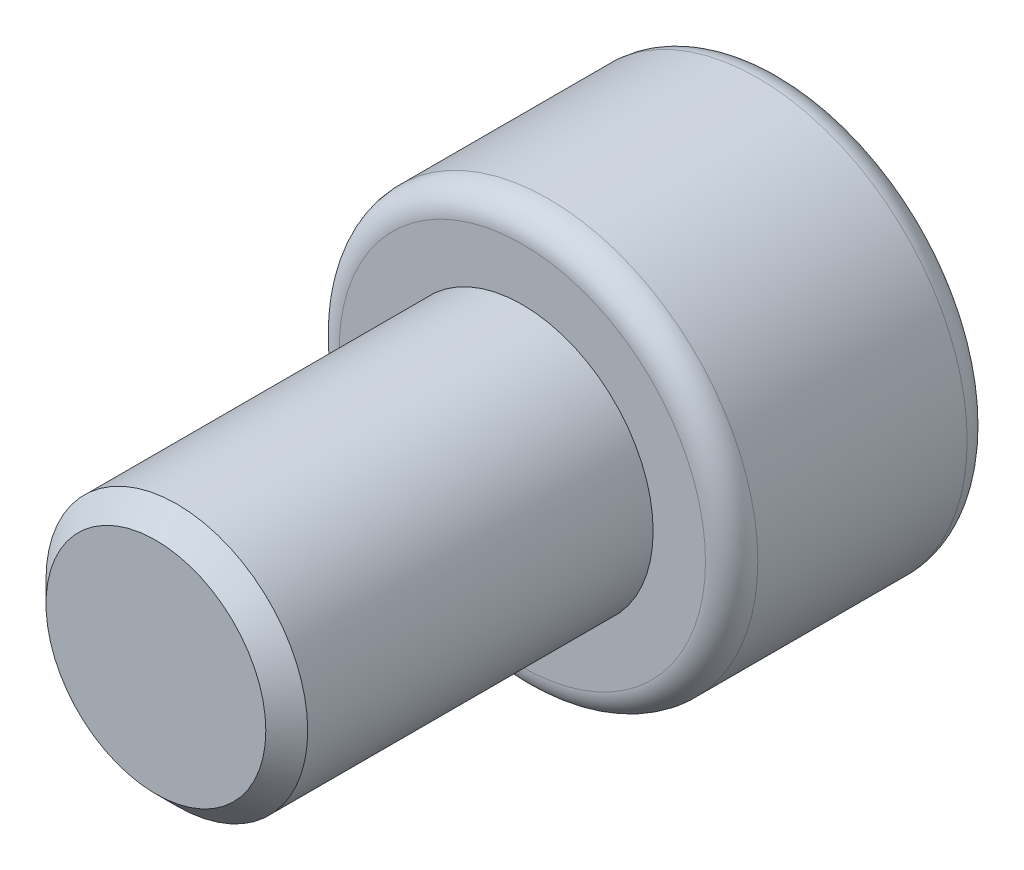
from build123d import *

# Parameters (mm, degrees)
ESBO_O1_R                = 4
RESSALTO_EXTRUS_O1_DEPTH = 5
ESBO_O2_R                = 2.5
RESSALTO_EXTRUS_O2_DEPTH = 7
CORTE_EXTRUS_O1_DEPTH    = 3
FILETE1_R                = 0.5
FILETE2_R                = 0.2
CHANFRO2_SIZE            = 0.4


with BuildPart() as part:
    # Esboço1 → Ressalto-extrusão1 (new body)
    with BuildSketch(Plane.XY):
        Circle(ESBO_O1_R)
    extrude(amount=RESSALTO_EXTRUS_O1_DEPTH)

    # Esboço2 → Ressalto-extrusão2 (add)
    with BuildSketch(Plane.XY.offset(5)):
        Circle(ESBO_O2_R)
    extrude(amount=RESSALTO_EXTRUS_O2_DEPTH)

    # Esboço3 → Corte-extrusão1 (cut)
    with BuildSketch(Plane(origin=(0, 0, 0), x_dir=(-1, 0, 0), z_dir=(0, 0, -1))):
        Polygon((0, 2.309401077), (-2, 1.154700538), (-2, -1.154700538), (0, -2.309401077), (2, -1.154700538), (2, 1.154700538), align=None)
    extrude(amount=-CORTE_EXTRUS_O1_DEPTH, mode=Mode.SUBTRACT)

    # Filete1
    filete1_edges = [part.edges().sort_by_distance(p)[0] for p in [
        (-4, 0, 0),
        (-4, 0, 5),
    ]]
    fillet(filete1_edges, radius=FILETE1_R)

    # Filete2
    filete2_edges = [part.edges().sort_by_distance(p)[0] for p in [
        (-1, 1.732050808, 0),
        (1, 1.732050808, 0),
        (2, 0, 0),
        (1, -1.732050808, 0),
        (-1, -1.732050808, 0),
        (-2, 0, 0),
    ]]
    fillet(filete2_edges, radius=FILETE2_R)

    # Chanfro2
    chanfro2_edges = [part.edges().sort_by_distance(p)[0] for p in [
        (-2.5, 0, 12),
    ]]
    chamfer(chanfro2_edges, length=CHANFRO2_SIZE)


solid = part.part
